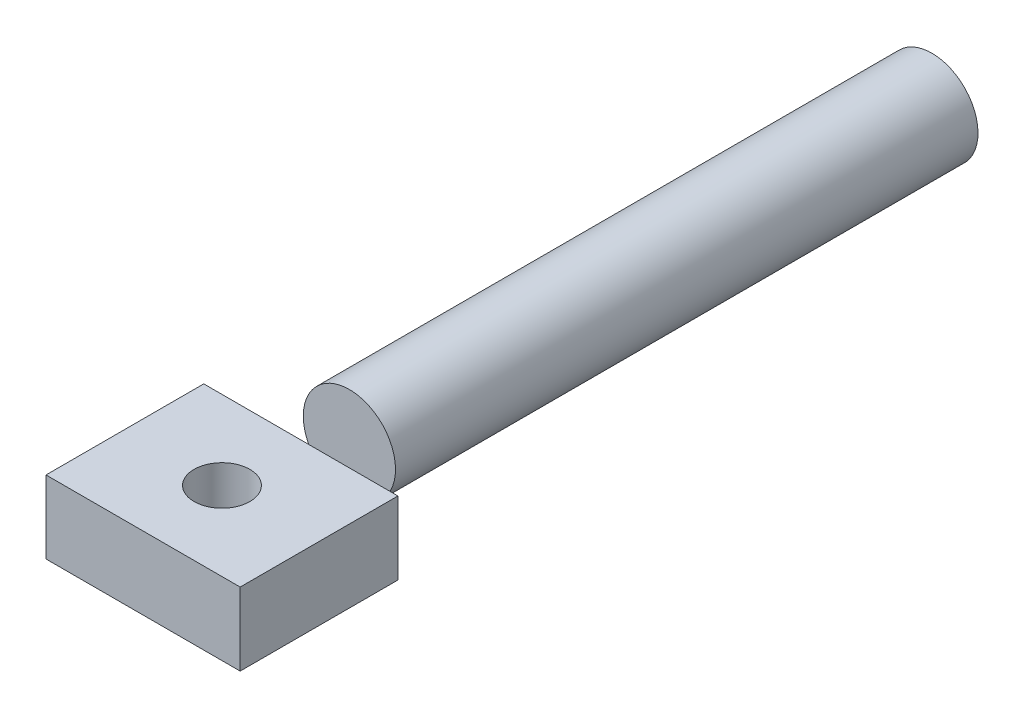
from build123d import *

# Parameters (mm, degrees)
ESBO_O1_W                = 8
ESBO_O1_H                = 6.5
ESBO_O1_R                = 1.15
RESSALTO_EXTRUS_O1_DEPTH = 3
ESBO_O2_W                = 4
ESBO_O2_H                = 0.815950815
RESSALTO_EXTRUS_O2_DEPTH = 2
ESBO_O3_R                = 1.9
RESSALTO_EXTRUS_O3_DEPTH = 24


with BuildPart() as part:
    # Esboço1 → Ressalto-extrusão1 (new body)
    with BuildSketch(Plane(origin=(0, 0, 0), x_dir=(1, 0, 0), z_dir=(0, 1, 0))):
        Rectangle(ESBO_O1_W, ESBO_O1_H)
        with Locations(Location((0, 0, 0), (0, 0, 270))):
            Circle(ESBO_O1_R, mode=Mode.SUBTRACT)
    extrude(amount=RESSALTO_EXTRUS_O1_DEPTH)

    # Esboço2 → Ressalto-extrusão2 (add)
    with BuildSketch(Plane(origin=(0, 0, -3.25), x_dir=(-1, 0, 0), z_dir=(0, 0, -1))):
        with Locations((0, 0.407975407)):
            Rectangle(ESBO_O2_W, ESBO_O2_H)
    extrude(amount=RESSALTO_EXTRUS_O2_DEPTH)

    # Esboço3 → Ressalto-extrusão3 (add)
    with BuildSketch(Plane(origin=(0, 0, -5.25), x_dir=(-1, 0, 0), z_dir=(0, 0, -1))):
        with Locations(Location((0, 1.9, 0), (0, 0, 214.788741518))):
            Circle(ESBO_O3_R)
    extrude(amount=RESSALTO_EXTRUS_O3_DEPTH)


solid = part.part
